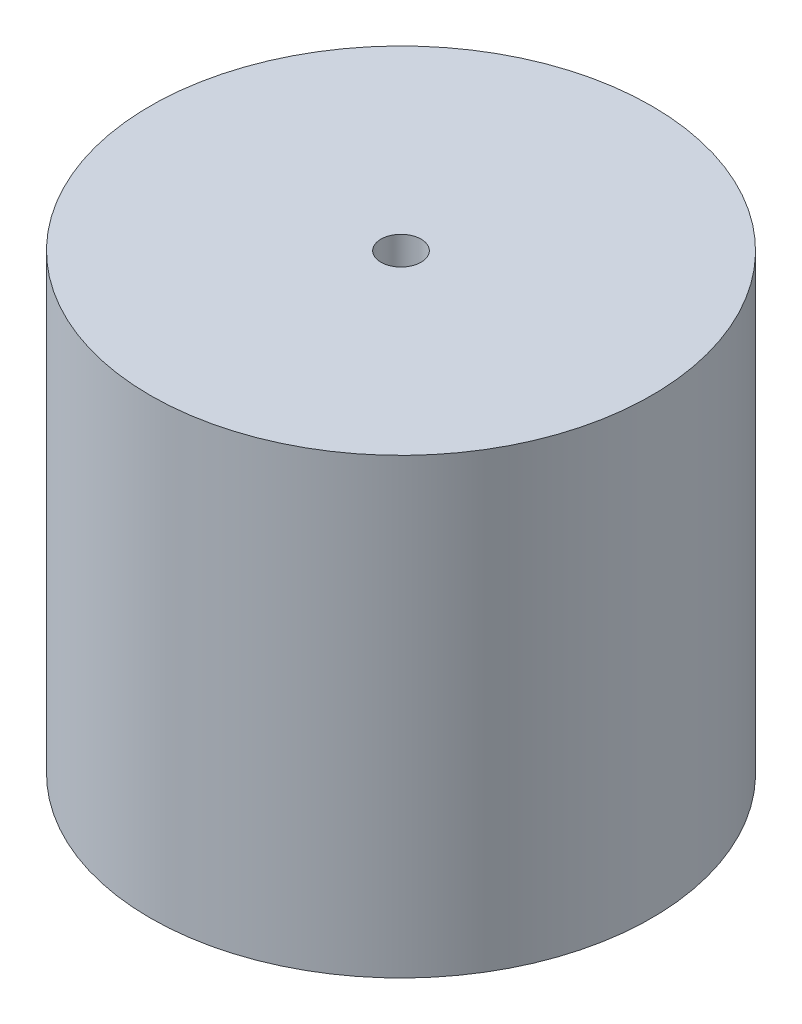
from build123d import *

# Parameters (mm, degrees)
SKETCH1_R           = 75
SKETCH1_R_2         = 6
BOSS_EXTRUDE1_DEPTH = 135.4
SKETCH3_R           = 65
CUT_EXTRUDE2_DEPTH  = 110
SKETCH4_R           = 75
SKETCH4_R_2         = 6
BOSS_EXTRUDE2_DEPTH = 10


with BuildPart() as part:
    # Sketch1 → Boss-Extrude1 (new body)
    with BuildSketch(Plane(origin=(0, 0, 0), x_dir=(1, 0, 0), z_dir=(0, 1, 0))):
        with Locations(Location((0, 0, 0), (0, 0, 270))):
            Circle(SKETCH1_R)
        with Locations(Location((0, 0, 0), (0, 0, 270))):
            Circle(SKETCH1_R_2, mode=Mode.SUBTRACT)
    extrude(amount=BOSS_EXTRUDE1_DEPTH)

    # Sketch3 → Cut-Extrude2 (cut)
    with BuildSketch(Plane.XZ):
        with Locations(Location((0, 0, 0), (0, 0, 270))):
            Circle(SKETCH3_R)
    extrude(amount=-CUT_EXTRUDE2_DEPTH, mode=Mode.SUBTRACT)

    # Sketch4 → Boss-Extrude2 (add)
    with BuildSketch(Plane.XZ):
        with Locations(Location((0, 0, 0), (0, 0, 90))):
            Circle(SKETCH4_R)
        with Locations(Location((0, 0, 0), (0, 0, 270))):
            Circle(SKETCH4_R_2, mode=Mode.SUBTRACT)
    extrude(amount=-BOSS_EXTRUDE2_DEPTH)


solid = part.part
